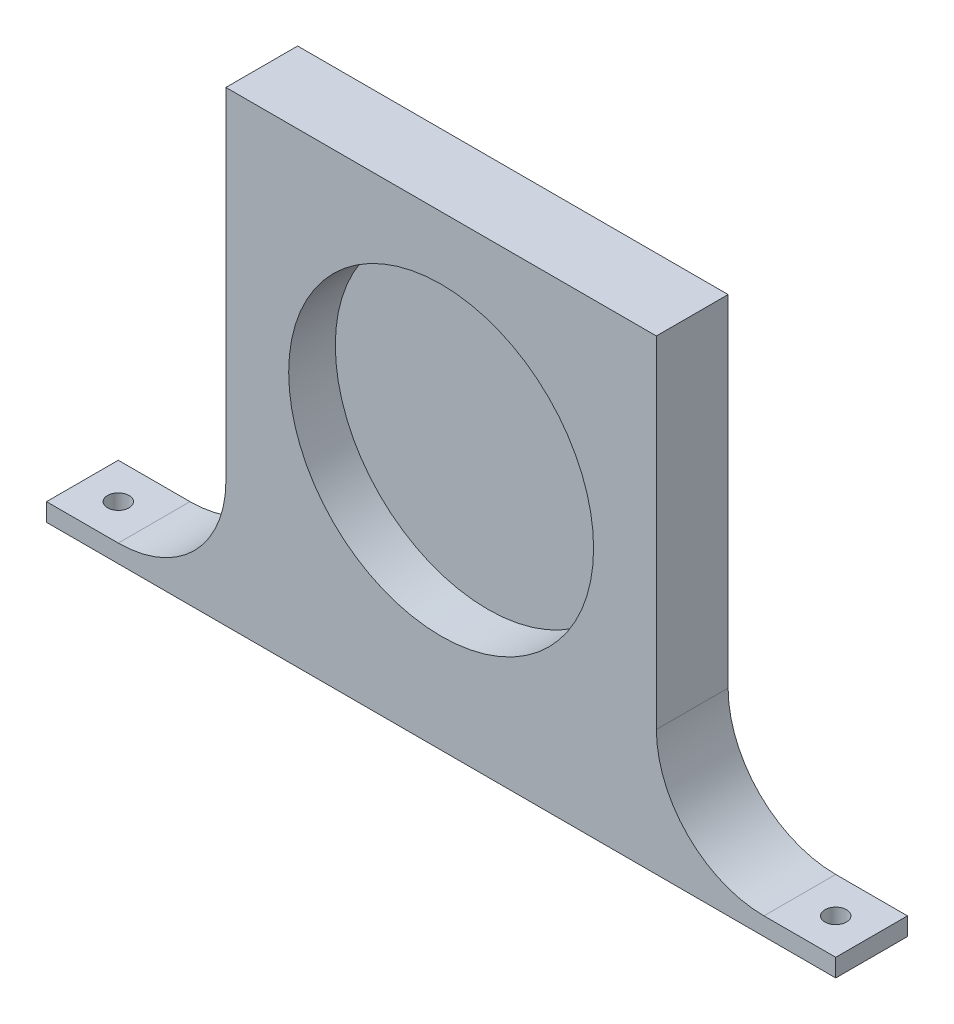
from build123d import *

# Parameters (mm, degrees)
SKETCH_1_W          = 120
SKETCH_1_H          = 130
EXTRUDE_1_DEPTH     = 20
SKETCH_2_R          = 42.5
CUT_EXTRUDE_1_DEPTH = 13
SKETCH_4_W          = 50
SKETCH_4_H          = 20
EXTRUDE_2_DEPTH     = 5
FILLET_2_R          = 30
FILLET_3_R          = 30
SKETCH_5_R          = 3
CUT_EXTRUDE_2_DEPTH = 168.705098312


with BuildPart() as part:
    # 草图1 → 凸台-拉伸1 (new body)
    with BuildSketch(Plane.XY):
        Rectangle(SKETCH_1_W, SKETCH_1_H)
    extrude(amount=EXTRUDE_1_DEPTH)

    # 草图2 → 切除-拉伸1 (cut)
    with BuildSketch(Plane.XY.offset(20)):
        with Locations((0, 5)):
            Circle(SKETCH_2_R)
    extrude(amount=-CUT_EXTRUDE_1_DEPTH, mode=Mode.SUBTRACT)

    # 草图4 → 凸台-拉伸2 (add)
    with BuildSketch(Plane.XZ.offset(65)):
        with Locations((85, 10)):
            Rectangle(SKETCH_4_W, SKETCH_4_H)
    extrude_2 = extrude(amount=-EXTRUDE_2_DEPTH)

    # 圆角2
    fillet_2_edges = [part.edges().sort_by_distance(p)[0] for p in [
        (60, -60, 10),
    ]]
    fillet(fillet_2_edges, radius=FILLET_2_R)

    # 镜向4: 凸台-拉伸2 across plane
    add(extrude_2.mirror(Plane(origin=(0, 0, 0), x_dir=(0, 0, 1), z_dir=(1, 0, 0))))

    # 圆角3
    fillet_3_edges = [part.edges().sort_by_distance(p)[0] for p in [
        (-60, -60, 10),
    ]]
    fillet(fillet_3_edges, radius=FILLET_3_R)

    # 草图5 → 切除-拉伸2 (cut, through all)
    with BuildSketch(Plane(origin=(0, -60, 0), x_dir=(1, 0, 0), z_dir=(0, 1, 0))):
        with Locations(Location((99.998041833, -10, 0), (0, 0, 270))):
            Circle(SKETCH_5_R)
    cut_extrude_2 = extrude(amount=-CUT_EXTRUDE_2_DEPTH, mode=Mode.SUBTRACT)

    # 镜向6: 切除-拉伸2 across plane
    add(cut_extrude_2.mirror(Plane(origin=(0, 0, 0), x_dir=(0, 0, 1), z_dir=(1, 0, 0))), mode=Mode.SUBTRACT)


solid = part.part
